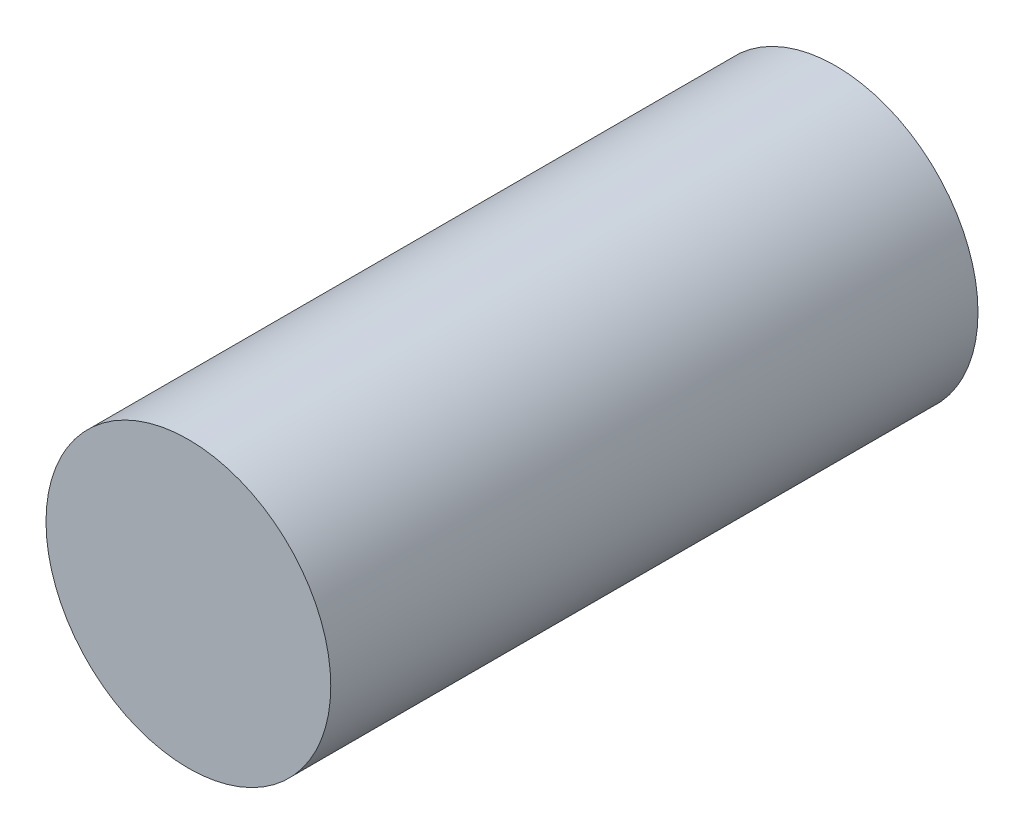
from build123d import *

# Parameters (mm, degrees)
SKETCH1_R           = 27.5
BOSS_EXTRUDE3_DEPTH = 125


with BuildPart() as part:
    # Sketch1 → Boss-Extrude3 (new body)
    with BuildSketch(Plane.XY):
        Circle(SKETCH1_R)
    extrude(amount=BOSS_EXTRUDE3_DEPTH)


solid = part.part
